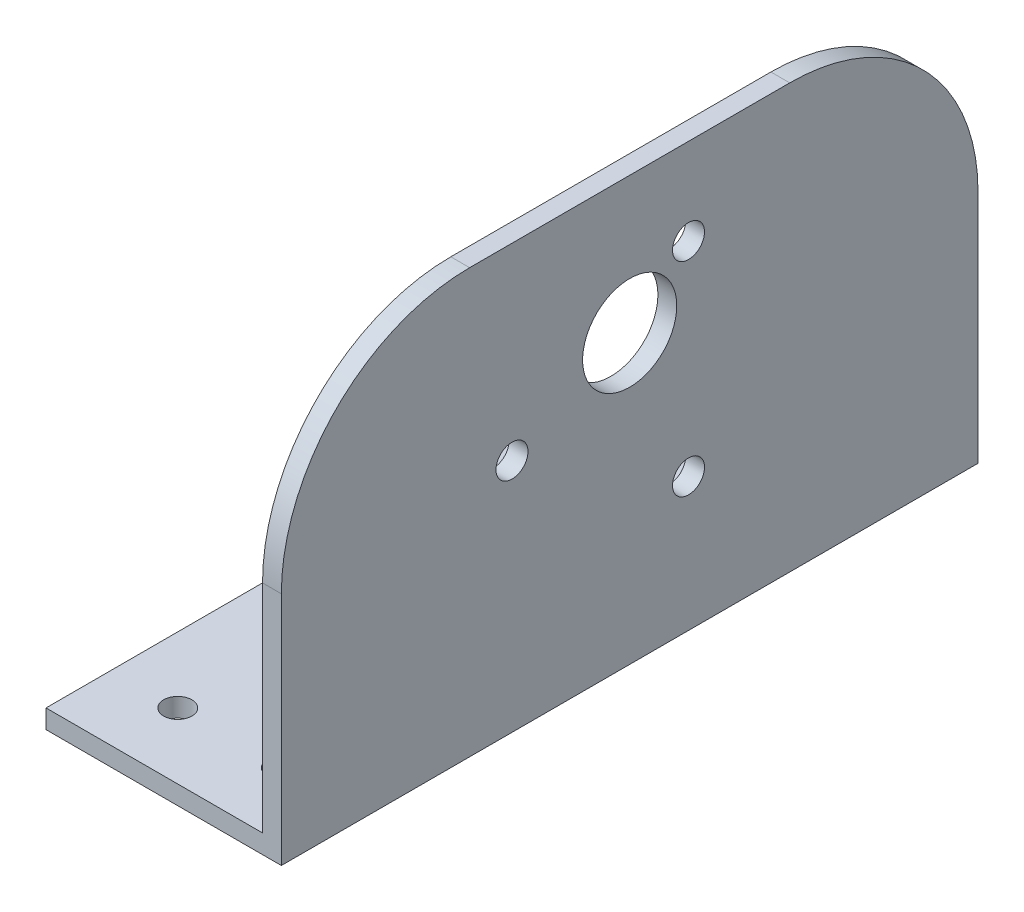
from build123d import *

# Parameters (mm, degrees)
BOSS_EXTRUDE3_DEPTH  = 74
SKETCH5_R            = 5
CUT_EXTRUDE1_DEPTH   = 91.144328718
M3_CLEARANCE_HOLE2_D = 3.4
SKETCH11_R           = 1.5
CUT_EXTRUDE2_DEPTH   = 90.162772501
FILLET1_R            = 20


with BuildPart() as part:
    # Sketch4 → Boss-Extrude3 (new body)
    with BuildSketch(Plane.XY):
        Polygon((0, 0), (25, 0), (25, 45), (23, 45), (23, 2), (0, 2), align=None)
    extrude(amount=BOSS_EXTRUDE3_DEPTH)

    # Sketch5 → Cut-Extrude1 (cut, through all)
    with BuildSketch(Plane(origin=(25, 0, 0), x_dir=(0, 0, -1), z_dir=(1, 0, 0))):
        with Locations((-37, 30.5)):
            Circle(SKETCH5_R)
    extrude(amount=-CUT_EXTRUDE1_DEPTH, mode=Mode.SUBTRACT)

    # M3 Clearance Hole2 (through all)
    with Locations(Plane(origin=(25, 0, 0), x_dir=(0, 0, -1), z_dir=(1, 0, 0))):
        with Locations((-30.75, 14.174682453), (-30.75, 35.825317547), (-49.5, 25)):
            Hole(M3_CLEARANCE_HOLE2_D / 2)

    # Sketch11 → Cut-Extrude2 (cut, through all)
    with BuildSketch(Plane(origin=(0, 2, 0), x_dir=(1, 0, 0), z_dir=(0, 1, 0))):
        with Locations(Location((7, -67, 0), (0, 0, 270))):
            Circle(SKETCH11_R)
        with Locations(Location((18, -67, 0), (0, 0, 270))):
            Circle(SKETCH11_R)
        with Locations(Location((18, -7, 0), (0, 0, 90))):
            Circle(SKETCH11_R)
        with Locations(Location((7, -7, 0), (0, 0, 90))):
            Circle(SKETCH11_R)
    extrude(amount=-CUT_EXTRUDE2_DEPTH, mode=Mode.SUBTRACT)

    # Fillet1
    fillet1_edges = [part.edges().sort_by_distance(p)[0] for p in [
        (24, 45, 74),
        (24, 45, 0),
    ]]
    fillet(fillet1_edges, radius=FILLET1_R)


solid = part.part
